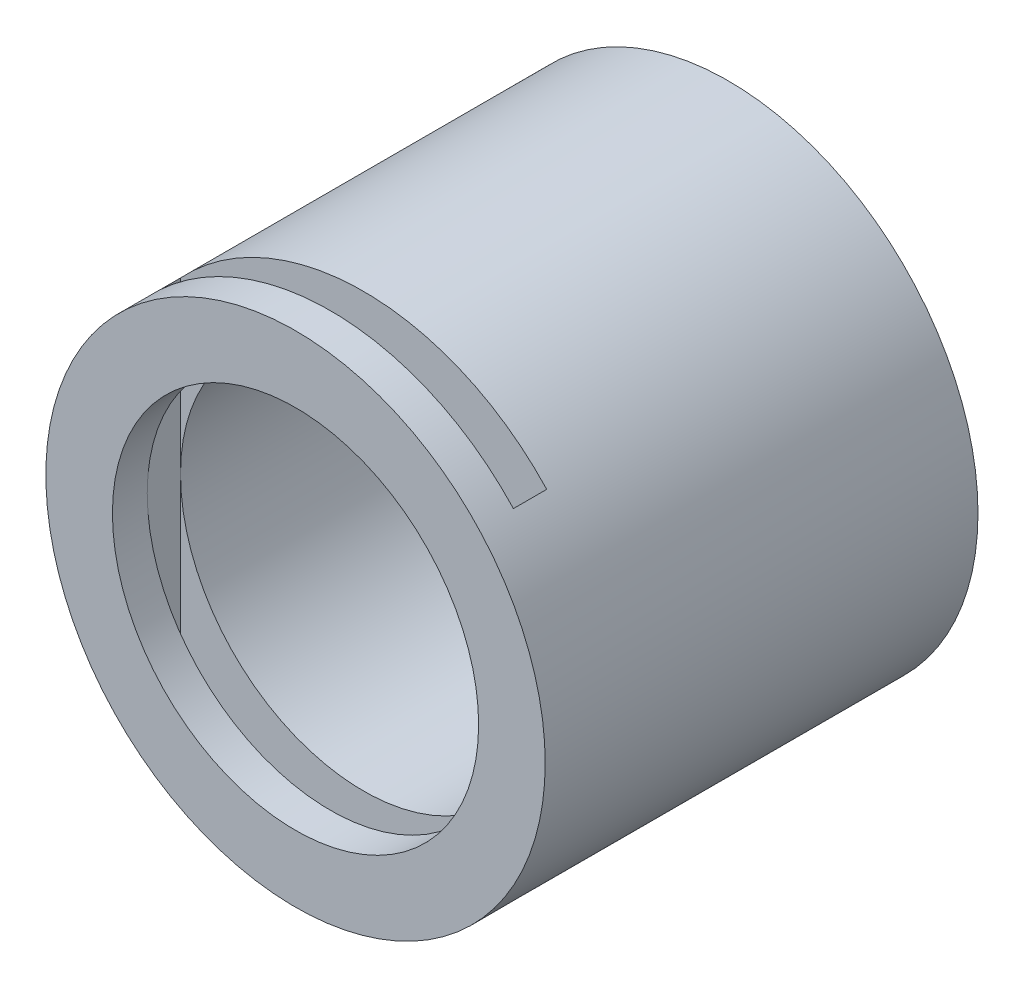
from build123d import *

# Parameters (mm, degrees)
SKETCH1_R               = 15
BOSS_EXTRUDE5_DEPTH     = 26
SKETCH3_R               = 5.625
CUT_EXTRUDE2_DEPTH      = 34.555923471
SKETCH4_R               = 11
CUT_EXTRUDE3_DEPTH      = 20
CUT_EXTRUDE4_DEPTH      = 34.555923471
CUT_EXTRUDE4_DEPTH_BACK = 34.555923471
SKETCH6_W               = 22
SKETCH6_H               = 2
CUT_EXTRUDE6_START      = 6
SKETCH7_R               = 11
SKETCH7_R_2             = 9
CUT_EXTRUDE6_DEPTH      = 2


with BuildPart() as part:
    # Sketch1 → Boss-Extrude5 (new body)
    with BuildSketch(Plane.XY):
        Circle(SKETCH1_R)
    extrude(amount=BOSS_EXTRUDE5_DEPTH)

    # Sketch3 → Cut-Extrude2 (cut, through all)
    with BuildSketch(Plane.XY.offset(26)):
        Circle(SKETCH3_R)
    extrude(amount=-CUT_EXTRUDE2_DEPTH, mode=Mode.SUBTRACT)

    # Sketch4 → Cut-Extrude3 (cut)
    with BuildSketch(Plane.XY.offset(26)):
        Circle(SKETCH4_R)
    extrude(amount=-CUT_EXTRUDE3_DEPTH, mode=Mode.SUBTRACT)

    # Sketch6 → Cut-Extrude4 (cut, two sides: drawn at the far end of the back side and taken through both)
    with BuildSketch(Plane(origin=(0, 0, 0), x_dir=(1, 0, 0), z_dir=(0, 1, 0)).offset(-CUT_EXTRUDE4_DEPTH_BACK)):
        with Locations((0, -22.90958557)):
            Rectangle(SKETCH6_W, SKETCH6_H)
    extrude(amount=CUT_EXTRUDE4_DEPTH + CUT_EXTRUDE4_DEPTH_BACK, mode=Mode.SUBTRACT)

    # Sketch7 → Cut-Extrude6 (cut)
    with BuildSketch(Plane.XY.offset(CUT_EXTRUDE6_START)):
        Circle(SKETCH7_R)
        Circle(SKETCH7_R_2, mode=Mode.SUBTRACT)
    extrude(amount=-CUT_EXTRUDE6_DEPTH, mode=Mode.SUBTRACT)


solid = part.part
